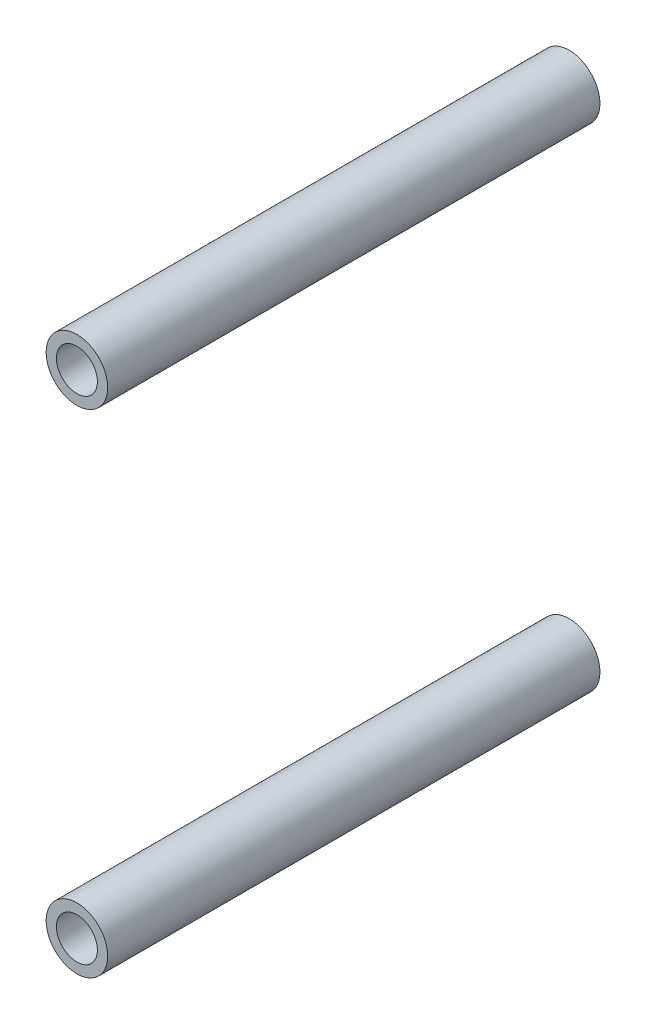
from build123d import *

# Parameters (mm, degrees)
SKETCH1_R        = 19.05
SKETCH1_R_2      = 12.7
EXTRUDE1_DEPTH   = 152.4
EXTRUDE1_2_DEPTH = 152.4


with BuildPart() as part:
    # Sketch1 → Extrude1 (new, symmetric)
    with BuildSketch(Plane.XY):
        with Locations((514.35, 152.4)):
            Circle(SKETCH1_R)
        with Locations((514.35, 152.4)):
            Circle(SKETCH1_R_2, mode=Mode.SUBTRACT)
    extrude(amount=EXTRUDE1_DEPTH, both=True)


with BuildPart() as body_2:
    # Sketch1 → Extrude1 2 (new, symmetric)
    with BuildSketch(Plane.XY):
        with Locations((514.35, -152.4)):
            Circle(SKETCH1_R)
        with Locations((514.35, -152.4)):
            Circle(SKETCH1_R_2, mode=Mode.SUBTRACT)
    extrude(amount=EXTRUDE1_2_DEPTH, both=True)


solid = Compound([part.part, body_2.part])
